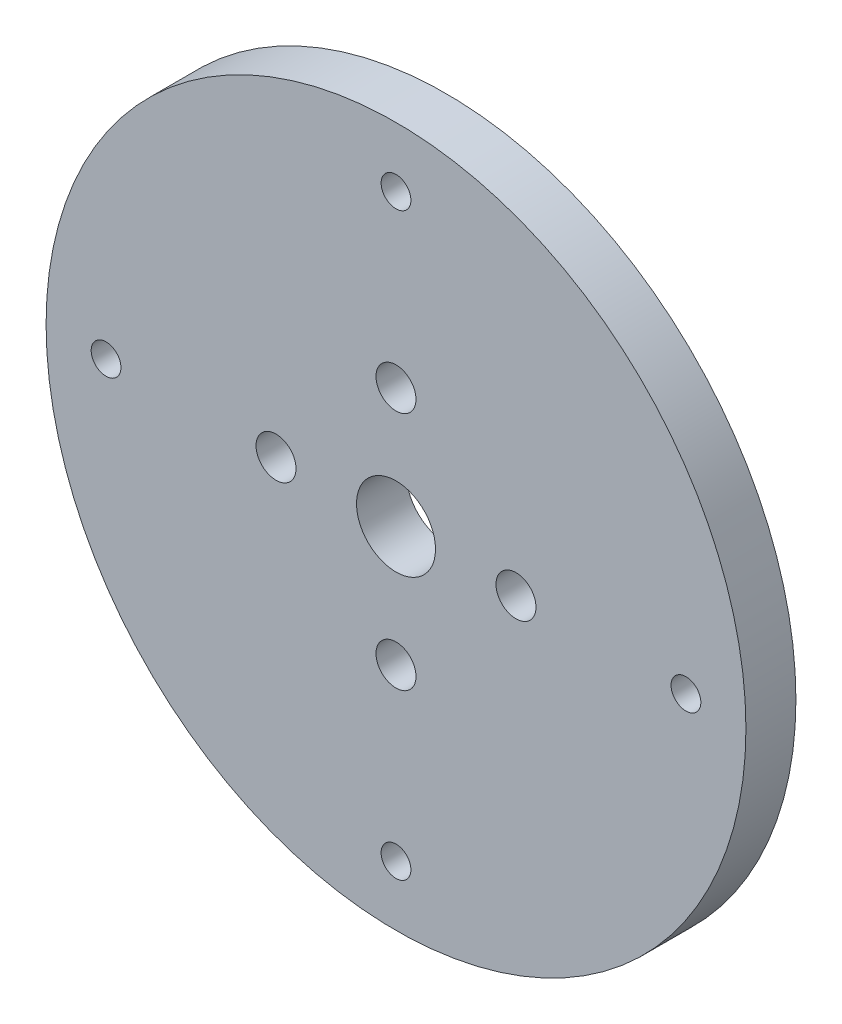
from build123d import *

# Parameters (mm, degrees)
SKETCH1_R           = 35
SKETCH1_R_2         = 3.95
SKETCH1_R_3         = 1.49
SKETCH1_R_4         = 2
BOSS_EXTRUDE1_DEPTH = 5


with BuildPart() as part:
    # Sketch1 → Boss-Extrude1 (new body)
    with BuildSketch(Plane.XY):
        Circle(SKETCH1_R)
        Circle(SKETCH1_R_2, mode=Mode.SUBTRACT)
        with Locations((-29, 0)):
            Circle(SKETCH1_R_3, mode=Mode.SUBTRACT)
        with Locations((29, 0)):
            Circle(SKETCH1_R_3, mode=Mode.SUBTRACT)
        with Locations((0, 29)):
            Circle(SKETCH1_R_3, mode=Mode.SUBTRACT)
        with Locations((0, -29)):
            Circle(SKETCH1_R_3, mode=Mode.SUBTRACT)
        with Locations((0, 12)):
            Circle(SKETCH1_R_4, mode=Mode.SUBTRACT)
        with Locations((12, 0)):
            Circle(SKETCH1_R_4, mode=Mode.SUBTRACT)
        with Locations((0, -12)):
            Circle(SKETCH1_R_4, mode=Mode.SUBTRACT)
        with Locations((-12, 0)):
            Circle(SKETCH1_R_4, mode=Mode.SUBTRACT)
    extrude(amount=BOSS_EXTRUDE1_DEPTH)


solid = part.part
